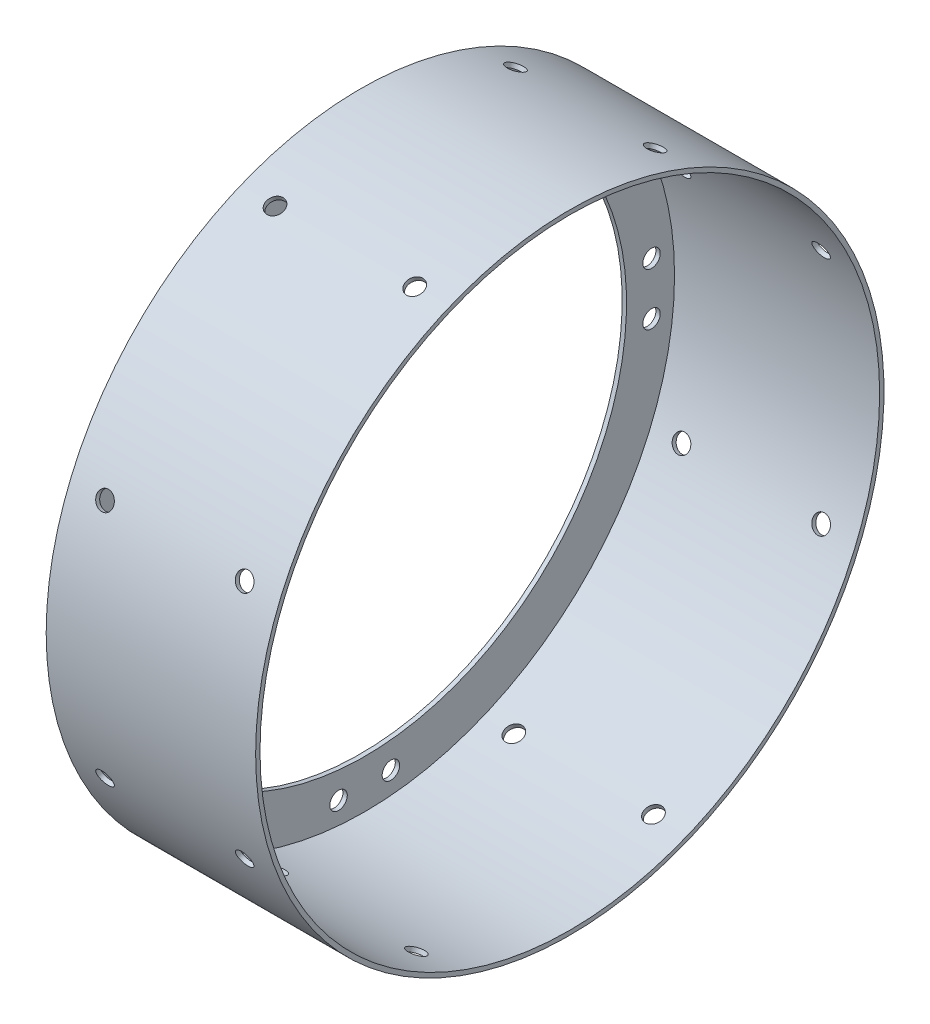
from build123d import *

# Parameters (mm, degrees)
SKETCH4_R          = 3.175
CUT_EXTRUDE1_DEPTH = 179.704840449
SKETCH5_R          = 3.175
CUT_EXTRUDE2_DEPTH = 2.54
CIRPATTERN1_COUNT  = 8


with BuildPart() as part:
    # Sketch3 → Revolve1 (revolve)
    with BuildSketch(Plane(origin=(0, 0, 0), x_dir=(1, 0, 0), z_dir=(0, 1, 0)), mode=Mode.PRIVATE) as revolve1_sk:
        Polygon((0, 114.3), (76.2, 114.3), (76.2, 112.7125), (1.5875, 112.7125), (1.5875, 95.25), (0, 95.25), align=None)
    revolve(revolve1_sk.sketch.rotate(Axis((0, 0, 0), (1, 0, 0)), 180), axis=Axis((0, 0, 0), (1, 0, 0)))

    # Sketch4 → Cut-Extrude1 (cut, through all)
    with BuildSketch(Plane.ZY):
        with Locations((9.525, 104.341147205)):
            Circle(SKETCH4_R)
        with Locations((-9.525, 104.341147205)):
            Circle(SKETCH4_R)
        with Locations((104.341147205, -9.525)):
            Circle(SKETCH4_R)
        with Locations((104.341147205, 9.525)):
            Circle(SKETCH4_R)
        with Locations((-9.525, -104.341147205)):
            Circle(SKETCH4_R)
        with Locations((9.525, -104.341147205)):
            Circle(SKETCH4_R)
        with Locations((-104.341147205, 9.525)):
            Circle(SKETCH4_R)
        with Locations((-104.341147205, -9.525)):
            Circle(SKETCH4_R)
    extrude(amount=-CUT_EXTRUDE1_DEPTH, mode=Mode.SUBTRACT)

    # Sketch5 → Cut-Extrude2 (cut)
    with BuildSketch(Plane(origin=(0, 76.372818314, -114.3), x_dir=(1, 0, 0), z_dir=(0, -0.9238795325112877, 0.38268343236508734))):
        with Locations(Location((12.7, 76.372818314, 0), (0, 0, 90))):
            Circle(SKETCH5_R)
        with Locations(Location((63.5, 76.372818314, 0), (0, 0, 90))):
            Circle(SKETCH5_R)
    cut_extrude2 = extrude(amount=CUT_EXTRUDE2_DEPTH, mode=Mode.SUBTRACT)

    # CirPattern1: Cut-Extrude2 ×8 about axis
    cirpattern1_axis = Axis((76.2, 0, 0), (-1, 0, 0))
    for i in range(1, CIRPATTERN1_COUNT):
        add(cut_extrude2.rotate(cirpattern1_axis, i * 360 / CIRPATTERN1_COUNT), mode=Mode.SUBTRACT)


solid = part.part
